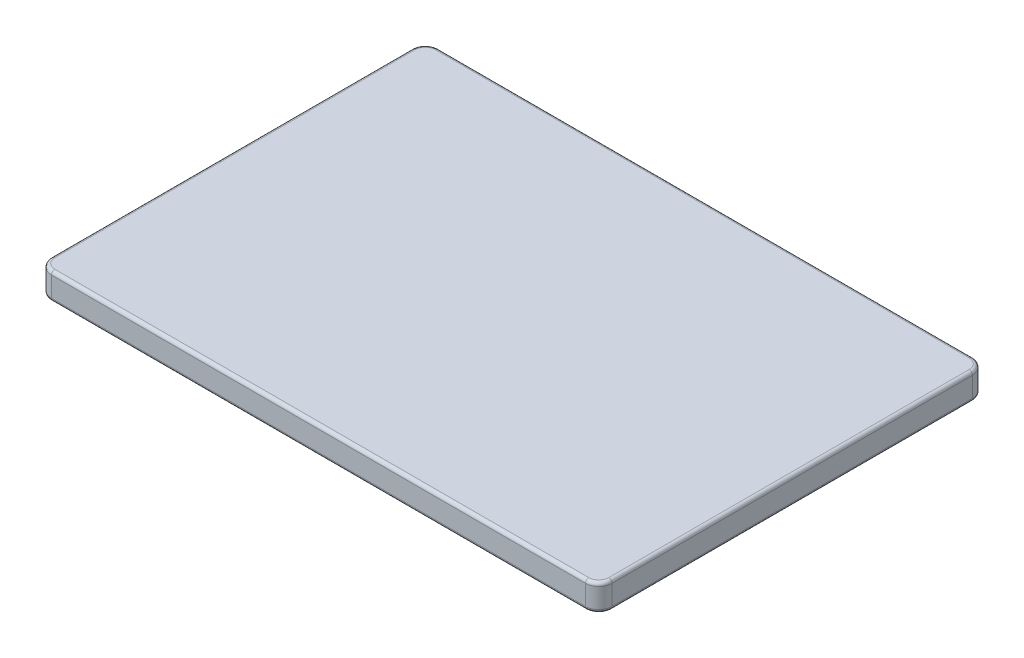
from build123d import *
from OCP.BRepFilletAPI import BRepFilletAPI_MakeFillet

# Parameters (mm, degrees)
SKETCH1_W           = 420
SKETCH1_H           = 290
BOSS_EXTRUDE1_DEPTH = 20
FILLET1_R1          = 10
FILLET1_R2          = 2.5


with BuildPart() as part:
    # Sketch1 → Boss-Extrude1 (new body)
    with BuildSketch(Plane(origin=(0, 0, 0), x_dir=(1, 0, 0), z_dir=(0, 1, 0))):
        Rectangle(SKETCH1_W, SKETCH1_H)
    extrude(amount=BOSS_EXTRUDE1_DEPTH)

    # Fillet1: one fillet with a radius per group of edges: ONE call of the kernel's fillet builder (fillet() takes one radius for all edges)
    fillet1_edges_1 = [part.edges().sort_by_distance(p)[0] for p in [
        (210, 10, 145),
        (-210, 10, 145),
        (-210, 10, -145),
        (210, 10, -145),
    ]]
    fillet1_edges_2 = [part.edges().sort_by_distance(p)[0] for p in [
        (210, 20, 0),
        (210, 0, 0),
        (0, 20, -145),
        (0, 0, -145),
        (-210, 20, 0),
        (-210, 0, 0),
        (0, 20, 145),
        (0, 0, 145),
    ]]
    fillet1 = BRepFilletAPI_MakeFillet(part.part.solid().wrapped)
    for e in fillet1_edges_1:
        fillet1.Add(FILLET1_R1, e.wrapped)
    for e in fillet1_edges_2:
        fillet1.Add(FILLET1_R2, e.wrapped)
    add(Compound.cast(fillet1.Shape()), mode=Mode.REPLACE)


solid = part.part
